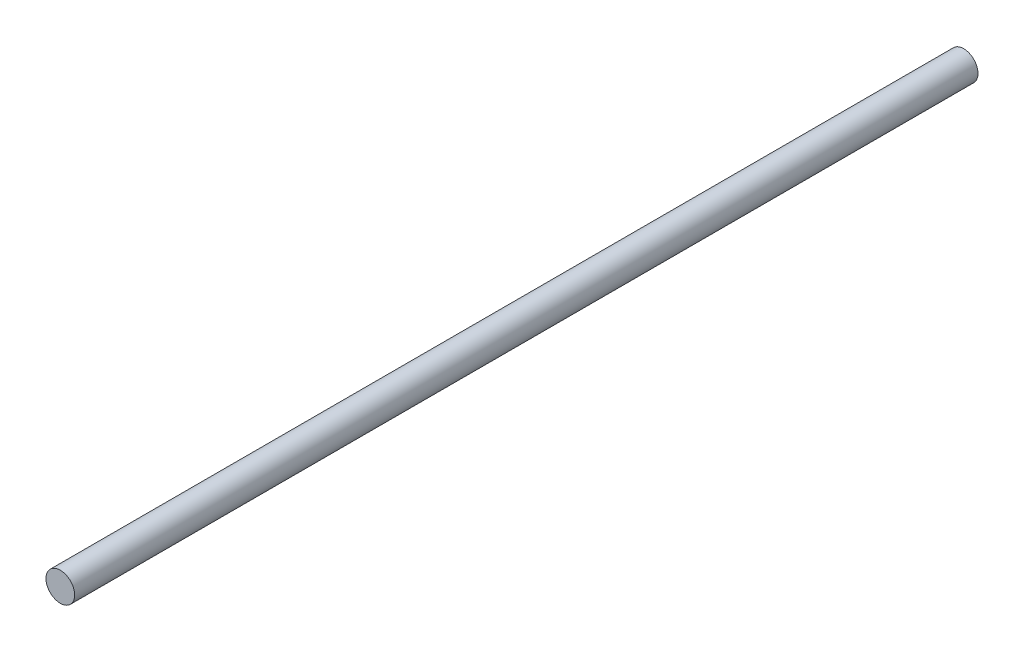
from build123d import *

# Parameters (mm, degrees)
SKETCH1_R           = 1.5875
BOSS_EXTRUDE1_DEPTH = 50


with BuildPart() as part:
    # Sketch1 → Boss-Extrude1 (new, symmetric)
    with BuildSketch(Plane.XY):
        Circle(SKETCH1_R)
    extrude(amount=BOSS_EXTRUDE1_DEPTH, both=True)


solid = part.part
